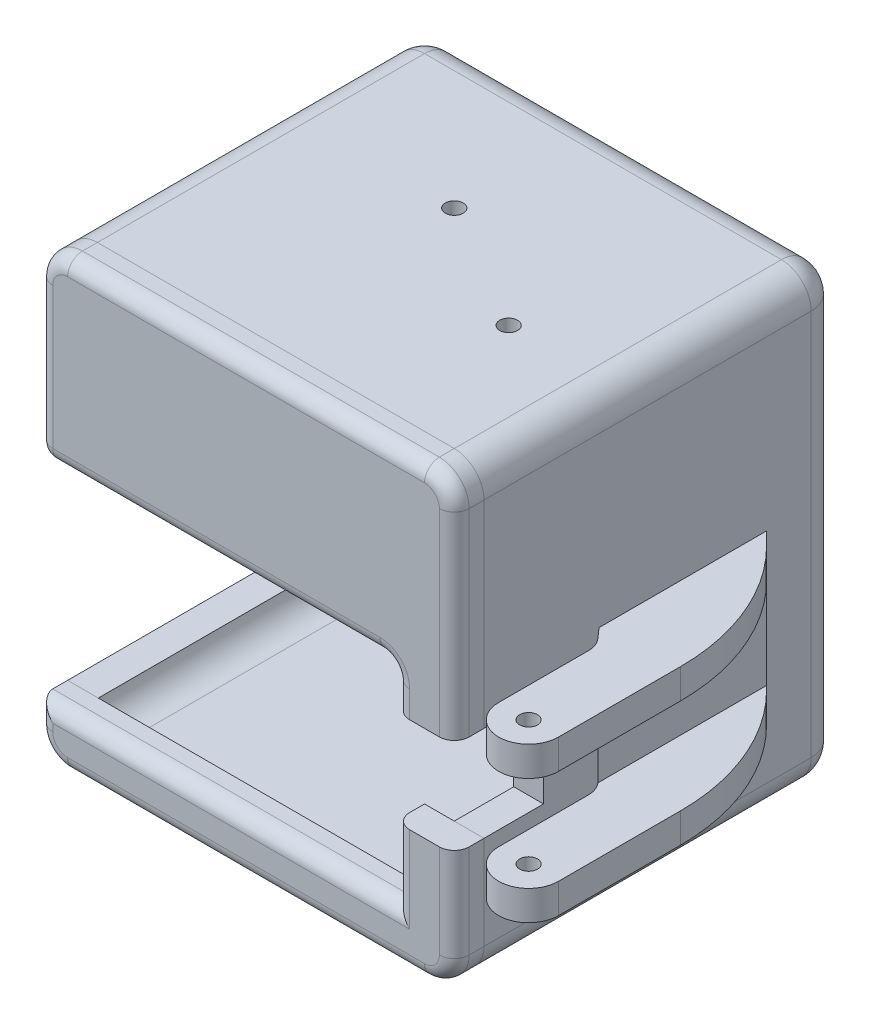
from build123d import *

# Parameters (mm, degrees)
SALIENTE_EXTRUIR1_DEPTH      = 70
SALIENTE_EXTRUIR1_DEPTH_BACK = 50
CROQUIS2_W                   = 150
CROQUIS2_H                   = 140
VACIADO1_T                   = -10
CORTAR_EXTRUIR1_DEPTH        = 134.999546005
CORTAR_EXTRUIR1_DEPTH_BACK   = 134.999546005
CROQUIS4_R                   = 3
REDONDEO9_R                  = 10
CROQUIS6_W                   = 130
CROQUIS6_H                   = 70
CORTAR_EXTRUIR3_DEPTH        = 100
SALIENTE_EXTRUIR2_DEPTH      = 10
REDONDEO17_R                 = 5
SALIENTE_EXTRUIR3_START      = 16
CROQUIS8_R                   = 3
SALIENTE_EXTRUIR3_DEPTH      = 10
SALIENTE_EXTRUIR4_DEPTH      = 25
CROQUIS11_W                  = 23.008413994
CROQUIS11_H                  = 32
CORTAR_EXTRUIR4_DEPTH        = 30


with BuildPart() as part:
    # Croquis2 → Saliente-Extruir1 (new, two sides: drawn at the far end of the back side and taken through both)
    with BuildSketch(Plane(origin=(0, 0, 0), x_dir=(0, 1, 0), z_dir=(0, 0, 1)).offset(-SALIENTE_EXTRUIR1_DEPTH_BACK)):
        with Locations((-6.570945305, -10.012869037)):
            Rectangle(CROQUIS2_W, CROQUIS2_H)
    extrude(amount=SALIENTE_EXTRUIR1_DEPTH + SALIENTE_EXTRUIR1_DEPTH_BACK)

    # Vaciado1
    vaciado1_openings = [part.faces().sort_by_distance(p)[0] for p in [
        (10.012869037, -6.570945305, 70),
    ]]
    offset(amount=VACIADO1_T, openings=vaciado1_openings, kind=Kind.INTERSECTION)

    # Croquis4 → Cortar-Extruir1 (cut, two sides: drawn at the far end of the back side and taken through both)
    with BuildSketch(Plane(origin=(0, 0, 0), x_dir=(-1, 0, 0), z_dir=(0, 1, 0)).offset(-CORTAR_EXTRUIR1_DEPTH_BACK)):
        Circle(CROQUIS4_R)
        with Locations((-43.301270189, 25)):
            Circle(CROQUIS4_R)
    extrude(amount=CORTAR_EXTRUIR1_DEPTH + CORTAR_EXTRUIR1_DEPTH_BACK, mode=Mode.SUBTRACT)

    # Redondeo9
    redondeo9_edges = [part.edges().sort_by_distance(p)[0] for p in [
        (-59.987130963, -6.570945305, -50),
        (-59.987130963, 68.429054695, 10),
        (10.012869037, -81.570945305, -50),
        (-59.987130963, -81.570945305, 10),
        (80.012869037, -6.570945305, -50),
        (80.012869037, -81.570945305, 10),
        (80.012869037, 68.429054695, 10),
        (10.012869037, 68.429054695, -50),
        (70.012869037, 58.429054695, 15),
        (70.012869037, -71.570945305, 15),
        (-49.987130963, 58.429054695, 15),
        (-49.987130963, -71.570945305, 15),
    ]]
    fillet(redondeo9_edges, radius=REDONDEO9_R)

    # Croquis6 → Cortar-Extruir3 (cut)
    with BuildSketch(Plane.XY.offset(70)):
        with Locations((5.012869037, -29.070945305)):
            Rectangle(CROQUIS6_W, CROQUIS6_H)
    extrude(amount=-CORTAR_EXTRUIR3_DEPTH, mode=Mode.SUBTRACT)


with BuildPart() as body_2:
    # Croquis7 → Saliente-Extruir2 (new body)
    with BuildSketch(Plane.XY.offset(70)):
        with BuildLine():
            Line((60.012869037, 5.929054695), (60.012869037, -8.070945305))
            Line((60.012869037, -8.070945305), (60.012869037, -40.070945305))
            Line((60.012869037, -40.070945305), (60.012869037, -64.070945305))
            Line((60.012869037, -64.070945305), (-59.987130963, -64.070945305))
            Line((-59.987130963, -64.070945305), (-59.987130963, -71.570945305))
            ThreePointArc((-59.987130963, -71.570945305), (-57.058198775, -78.642013117), (-49.987130963, -81.570945305))
            Line((-49.987130963, -81.570945305), (70.012869037, -81.570945305))
            ThreePointArc((70.012869037, -81.570945305), (77.083936849, -78.642013117), (80.012869037, -71.570945305))
            Line((80.012869037, -71.570945305), (80.012869037, -40.070945305))
            Line((80.012869037, -40.070945305), (80.012869037, -8.070945305))
            Line((80.012869037, -8.070945305), (80.012869037, 58.429054695))
            ThreePointArc((80.012869037, 58.429054695), (77.083936849, 65.500122507), (70.012869037, 68.429054695))
            Line((70.012869037, 68.429054695), (-49.987130963, 68.429054695))
            ThreePointArc((-49.987130963, 68.429054695), (-57.058198775, 65.500122507), (-59.987130963, 58.429054695))
            Line((-59.987130963, 58.429054695), (-59.987130963, 5.929054695))
            Line((-59.987130963, 5.929054695), (60.012869037, 5.929054695))
        make_face()
    extrude(amount=SALIENTE_EXTRUIR2_DEPTH)

    # Redondeo17
    redondeo17_edges = [body_2.edges().sort_by_distance(p)[0] for p in [
        (-59.987130963, -67.820945305, 80),
        (-57.058198775, -78.642013117, 80),
        (10.012869037, -81.570945305, 80),
        (77.083936849, -78.642013117, 80),
        (80.012869037, -6.570945305, 80),
        (77.083936849, 65.500122507, 80),
        (10.012869037, 68.429054695, 80),
        (-57.058198775, 65.500122507, 80),
        (-59.987130963, 32.179054695, 80),
        (60.012869037, 5.929054695, 75),
        (60.012869037, -29.070945305, 80),
        (0.012869037, -64.070945305, 80),
        (0.012869037, 5.929054695, 80),
        (-59.987130963, 5.929054695, 75),
    ]]
    fillet(redondeo17_edges, radius=REDONDEO17_R)


with BuildPart() as body_3:
    # Croquis8 → Saliente-Extruir3 (new body)
    with BuildSketch(Plane(origin=(0, -24.070945305, 0), x_dir=(1, 0, 0), z_dir=(0, 1, 0)).offset(SALIENTE_EXTRUIR3_START)):
        with BuildLine():
            Line((80.012869037, 25), (84.555109789, 20.457759248))
            ThreePointArc((84.555109789, 20.457759248), (99.729202381, -2.25187517), (105.057635106, -29.039715435))
            Line((105.057635106, -29.039715435), (105.057635106, -70))
            ThreePointArc((105.057635106, -70), (95, -80.057635106), (84.942364894, -70))
            Line((84.942364894, -70), (84.942364894, -39.807745342))
            ThreePointArc((84.942364894, -39.807745342), (84.446046379, -37.092604956), (83.021283031, -34.728631862))
            Line((83.021283031, -34.728631862), (80.012869037, -31.320625087))
            Line((80.012869037, -31.320625087), (80.012869037, 25))
        make_face()
        with Locations((95, -70)):
            Circle(CROQUIS8_R, mode=Mode.SUBTRACT)
    extrude(amount=SALIENTE_EXTRUIR3_DEPTH)


with BuildPart() as body_4:
    # Simetría1: mirrored copy
    add(body_3.part.mirror(Plane.ZX.offset(-24.070945305)))


    add(body_3.part)  # Saliente-Extruir4 merges body 3
    # Croquis10 → Saliente-Extruir4 (add, symmetric)
    with BuildSketch(Plane(origin=(0, -24.070945305, 0), x_dir=(1, 0, 0), z_dir=(0, 1, 0))):
        Polygon((83.021283031, -34.728631862), (83.021283031, 21.991586006), (80.012869037, 25), (80.012869037, -31.320625087), align=None)
    extrude(amount=SALIENTE_EXTRUIR4_DEPTH, both=True)


with BuildPart() as cortar_extruir4_tool:
    # Croquis11 → Cortar-Extruir4 (new body)
    with BuildSketch(Plane.XY.offset(80)):
        with Locations((71.517076034, -24.070945305)):
            Rectangle(CROQUIS11_W, CROQUIS11_H)
    extrude(amount=-CORTAR_EXTRUIR4_DEPTH)


with BuildPart() as part_1:
    add(part.part)

    # Cortar-Extruir4: cut by cortar_extruir4_tool
    add(cortar_extruir4_tool.part, mode=Mode.SUBTRACT)


with BuildPart() as body_2_1:
    add(body_2.part)

    # Cortar-Extruir4: cut by cortar_extruir4_tool
    add(cortar_extruir4_tool.part, mode=Mode.SUBTRACT)


solid = Compound([body_4.part, part_1.part, body_2_1.part])
